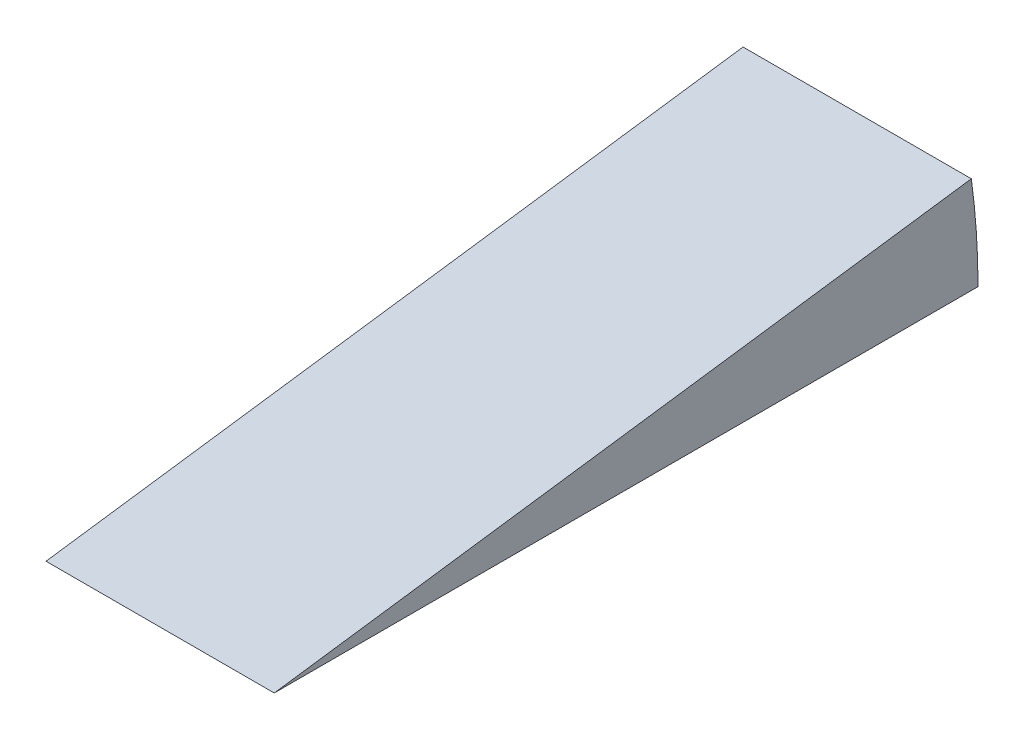
from build123d import *

# Parameters (mm, degrees)
CROQUIS1_W              = 24
CROQUIS1_H              = 144
SALIENTE_EXTRUIR1_DEPTH = 20
CORTAR_EXTRUIR2_DEPTH   = 148.349923651
CROQUIS4_W              = 24
CROQUIS4_H              = 70


with BuildPart() as part:
    # Croquis1 → Saliente-Extruir1 (new body)
    with BuildSketch(Plane(origin=(0, 0, 0), x_dir=(1, 0, 0), z_dir=(0, 1, 0))):
        with Locations((12, 72)):
            Rectangle(CROQUIS1_W, CROQUIS1_H)
    extrude(amount=SALIENTE_EXTRUIR1_DEPTH)

    # Croquis3 → Cortar-Extruir2 (cut, through all)
    with BuildSketch(Plane(origin=(24, 0, 0), x_dir=(0, 0, -1), z_dir=(1, 0, 0))):
        Polygon((144, 20), (0, 0), (0, 20), align=None)
    extrude(amount=-CORTAR_EXTRUIR2_DEPTH, mode=Mode.SUBTRACT)

    # Croquis4 → Cortar-Revolución2 (revolve, cut)
    with BuildSketch(Plane.XZ):
        with Locations((12, -109)):
            Rectangle(CROQUIS4_W, CROQUIS4_H)
    revolve(axis=Axis((0, 0, 0), (1, 0, 0)), mode=Mode.SUBTRACT)


with BuildPart() as body_2:
    # of the pieces the cut leaves, the one that is kept (cortar_revoluci_n2_keep)
    add(part.part.solids().sort_by_distance((0, 0, -74))[0])


solid = body_2.part
